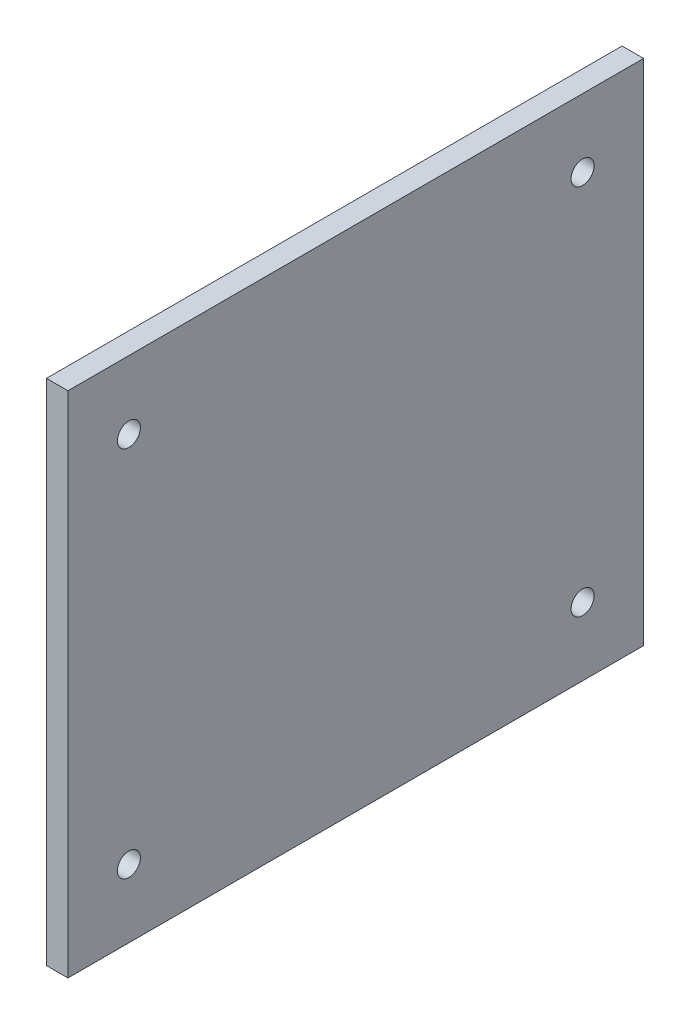
from build123d import *

# Parameters (mm, degrees)
SKETCH1_W           = 85
SKETCH1_H           = 75.1
SKETCH1_R           = 1.7
BOSS_EXTRUDE1_DEPTH = 3.175


with BuildPart() as part:
    # Sketch1 → Boss-Extrude1 (new body)
    with BuildSketch(Plane(origin=(0, 0, 0), x_dir=(0, 0, -1), z_dir=(1, 0, 0))):
        with Locations((42.5, 37.55)):
            Rectangle(SKETCH1_W, SKETCH1_H)
        with Locations((9, 65.05)):
            Circle(SKETCH1_R, mode=Mode.SUBTRACT)
        with Locations(Location((9, 10.05, 0), (0, 0, 180))):
            Circle(SKETCH1_R, mode=Mode.SUBTRACT)
        with Locations((76, 10.05)):
            Circle(SKETCH1_R, mode=Mode.SUBTRACT)
        with Locations(Location((76, 65.05, 0), (0, 0, 180))):
            Circle(SKETCH1_R, mode=Mode.SUBTRACT)
    extrude(amount=BOSS_EXTRUDE1_DEPTH)


solid = part.part
